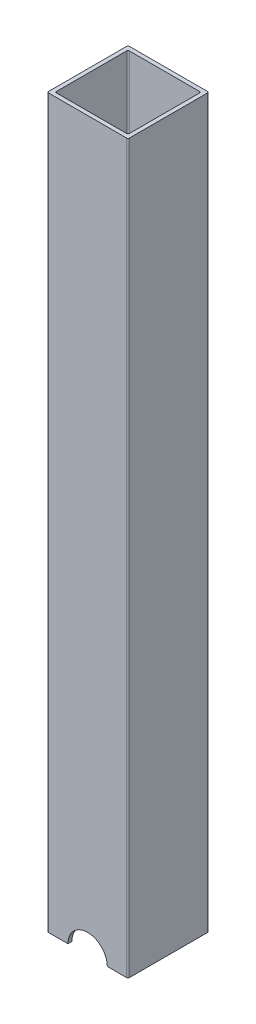
from build123d import *

# Parameters (mm, degrees)
SKETCH1_W           = 25.4
SKETCH1_H           = 25.4
SKETCH1_W_2         = 22.9108
SKETCH1_H_2         = 22.9108
BOSS_EXTRUDE1_DEPTH = 228.6
FILLET1_R           = 0.4064
SKETCH2_R           = 6.19125
CUT_EXTRUDE1_DEPTH  = 232.40501291


with BuildPart() as part:
    # Sketch1 → Boss-Extrude1 (new body)
    with BuildSketch(Plane(origin=(0, 0, 0), x_dir=(1, 0, 0), z_dir=(0, 1, 0))):
        with Locations((12.7, 12.7)):
            Rectangle(SKETCH1_W, SKETCH1_H)
        with Locations((12.7, 12.7)):
            Rectangle(SKETCH1_W_2, SKETCH1_H_2, mode=Mode.SUBTRACT)
    extrude(amount=-BOSS_EXTRUDE1_DEPTH)

    # Fillet1
    fillet1_edges = [part.edges().sort_by_distance(p)[0] for p in [
        (1.2446, -114.3, -1.2446),
        (1.2446, -114.3, -24.1554),
        (24.1554, -114.3, -24.1554),
        (24.1554, -114.3, -1.2446),
        (0, -114.3, -25.4),
        (25.4, -114.3, -25.4),
        (25.4, -114.3, 0),
        (0, -114.3, 0),
    ]]
    fillet(fillet1_edges, radius=FILLET1_R)

    # Sketch2 → Cut-Extrude1 (cut, through all)
    with BuildSketch(Plane(origin=(0, 0, -25.4), x_dir=(-1, 0, 0), z_dir=(0, 0, -1))):
        with Locations((-12.7, -228.6)):
            Circle(SKETCH2_R)
    extrude(amount=-CUT_EXTRUDE1_DEPTH, mode=Mode.SUBTRACT)


solid = part.part
